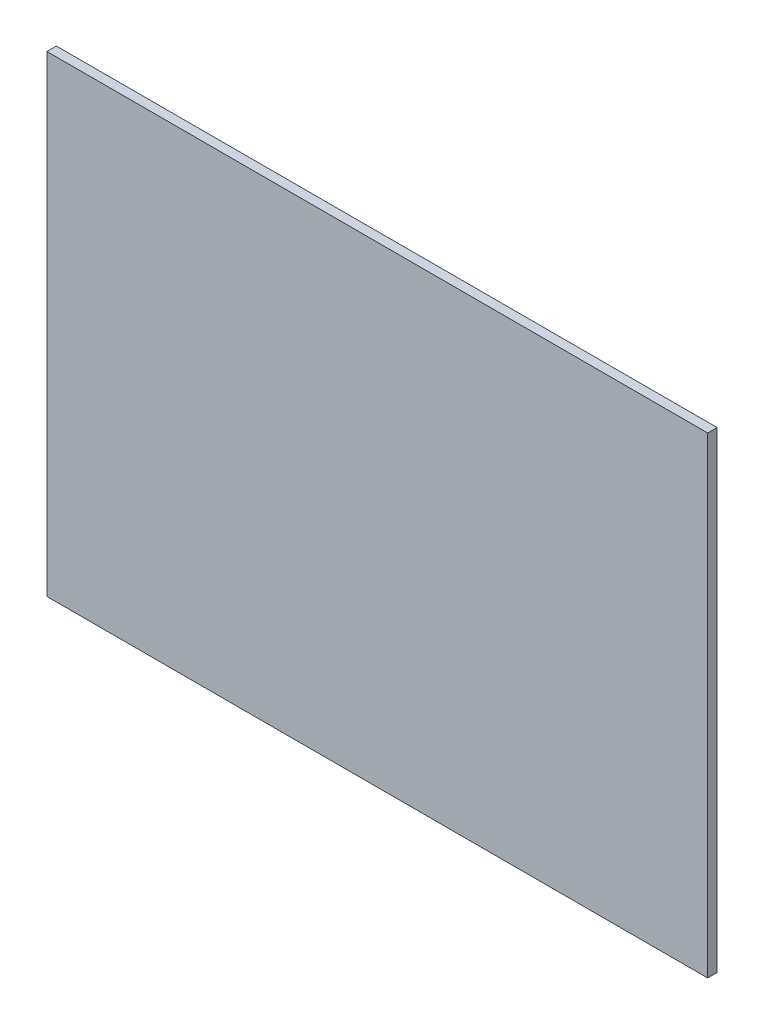
from build123d import *

# Parameters (mm, degrees)
ESQUISSE1_W        = 700
ESQUISSE1_H        = 500
BOSS_EXTRU_1_DEPTH = 10


with BuildPart() as part:
    # Esquisse1 → Boss.-Extru.1 (new body)
    with BuildSketch(Plane.XY):
        with Locations((-350, 250)):
            Rectangle(ESQUISSE1_W, ESQUISSE1_H)
    extrude(amount=BOSS_EXTRU_1_DEPTH)


solid = part.part
